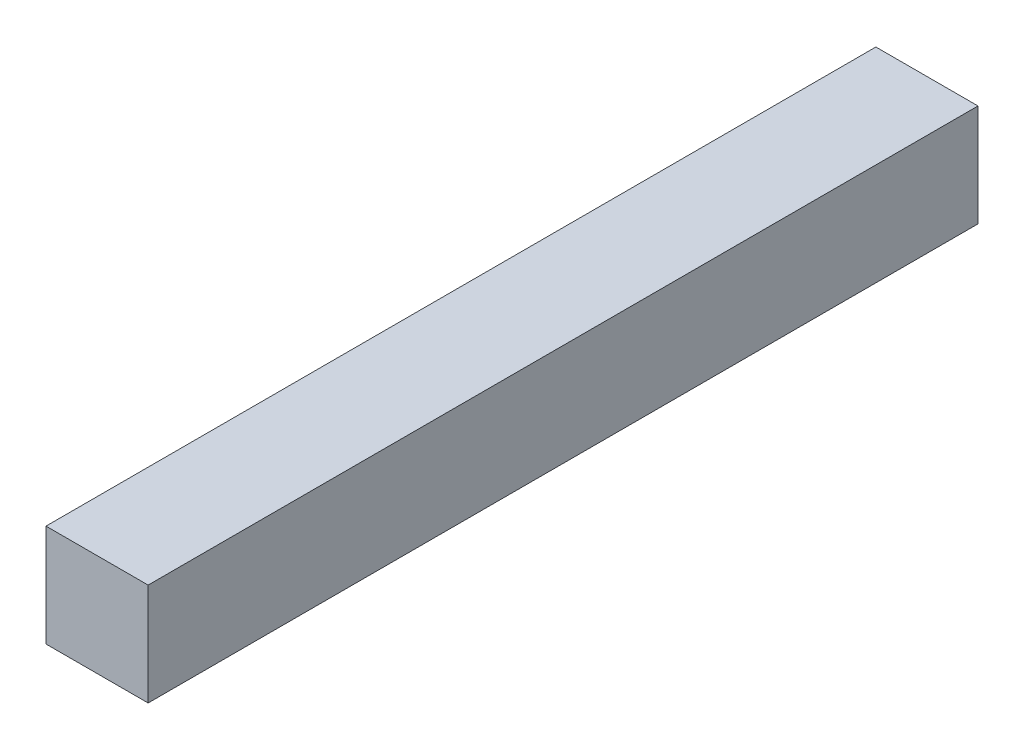
from build123d import *

# Parameters (mm, degrees)
ESBO_O1_W                = 8
ESBO_O1_H                = 8
RESSALTO_EXTRUS_O1_DEPTH = 65


with BuildPart() as part:
    # Esboço1 → Ressalto-extrusão1 (new body)
    with BuildSketch(Plane.XY):
        with Locations((4, 4)):
            Rectangle(ESBO_O1_W, ESBO_O1_H)
    extrude(amount=RESSALTO_EXTRUS_O1_DEPTH)


solid = part.part
